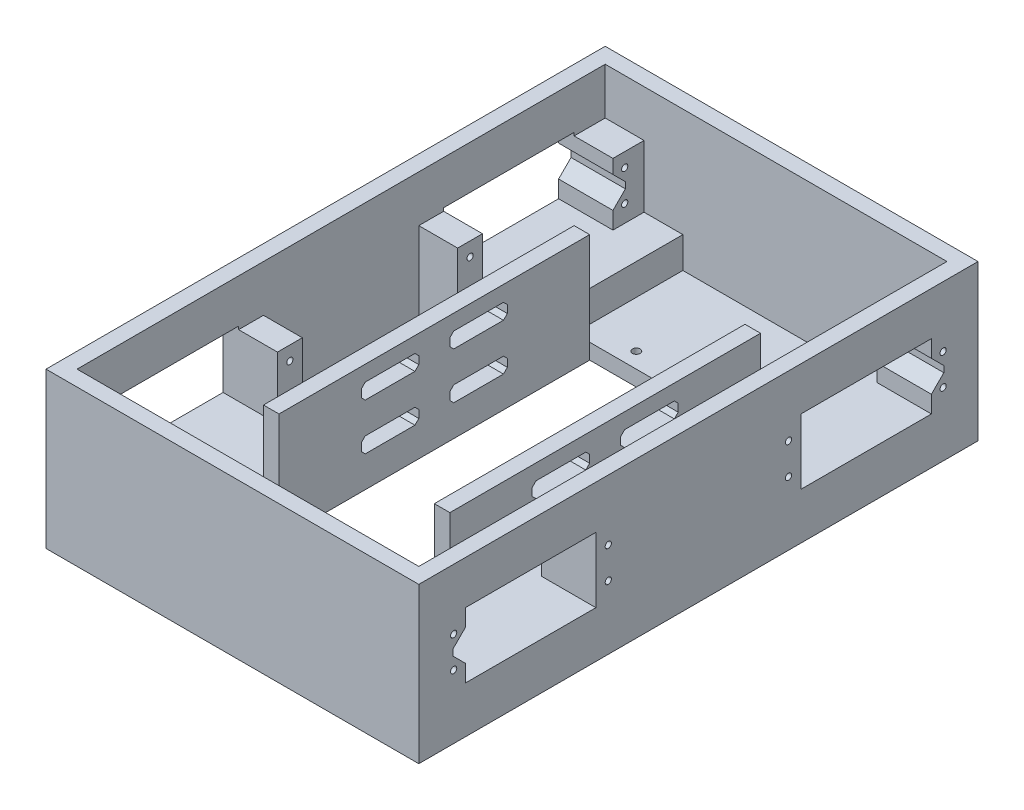
from build123d import *

# Parameters (mm, degrees)
SKETCH1_W               = 120
SKETCH1_H               = 180
BOSS_EXTRUDE1_DEPTH     = 50
SHELL1_T                = -5
SKETCH2_W               = 5
SKETCH2_H               = 100
BOSS_EXTRUDE2_DEPTH     = 30
SKETCH3_W               = 25
SKETCH3_H               = 60
BOSS_EXTRUDE3_DEPTH     = 30
CUT_EXTRUDE1_REACH      = 224.036
SKETCH4_R               = 1
SKETCH5_W               = 12.5
SKETCH5_H               = 60
CUT_EXTRUDE2_DEPTH      = 20
CUT_EXTRUDE4_DEPTH      = 10
SKETCH6_R               = 1.25
SKETCH6_W               = 50
SKETCH6_H               = 100
CUT_EXTRUDE3_DEPTH      = 10
MIRROR2_COPY_1_SKETCH_W = 25
MIRROR2_COPY_1_SKETCH_H = 60
MIRROR2_COPY_1_DEPTH    = 30
MIRROR2_COPY_2_REACH    = 224.036
MIRROR2_COPY_2_SKETCH_R = 1
MIRROR2_COPY_3_SKETCH_W = 12.5
MIRROR2_COPY_3_SKETCH_H = 60
MIRROR2_COPY_3_DEPTH    = 20
MIRROR2_COPY_4_DEPTH    = 10


with BuildPart() as part:
    # Sketch1 → Boss-Extrude1 (new body)
    with BuildSketch(Plane(origin=(0, 0, 0), x_dir=(1, 0, 0), z_dir=(0, 1, 0))):
        with Locations((0, 90)):
            Rectangle(SKETCH1_W, SKETCH1_H)
    extrude(amount=BOSS_EXTRUDE1_DEPTH)

    # Shell1
    shell1_openings = [part.faces().sort_by_distance(p)[0] for p in [
        (0, 50, -90),
    ]]
    offset(amount=SHELL1_T, openings=shell1_openings, kind=Kind.INTERSECTION)

    # Sketch2 → Boss-Extrude2 (add)
    with BuildSketch(Plane(origin=(0, 5, 0), x_dir=(1, 0, 0), z_dir=(0, 1, 0))):
        with Locations((-27.5, 90)):
            Rectangle(SKETCH2_W, SKETCH2_H)
        with Locations((27.5, 90)):
            Rectangle(SKETCH2_W, SKETCH2_H)
    extrude(amount=BOSS_EXTRUDE2_DEPTH)

    # Sketch3 → Boss-Extrude3 (add)
    with BuildSketch(Plane(origin=(0, 5, 0), x_dir=(1, 0, 0), z_dir=(0, 1, 0))):
        with Locations((-42.5, 35)):
            Rectangle(SKETCH3_W, SKETCH3_H)
    boss_extrude3 = extrude(amount=BOSS_EXTRUDE3_DEPTH)

    # Cut-Extrude1: up to this face of the body (flat: up to its plane)
    cut_extrude1_end = Plane(part.part.faces().sort_by_distance((-30, 20, -102.5))[0])
    # Sketch4 → Cut-Extrude1 (cut, up to the picked face)
    with BuildSketch(Plane.ZY.offset(60), mode=Mode.PRIVATE) as cut_extrude1_sk1:
        with Locations((-61, 30.5)):
            Circle(SKETCH4_R)
    cut_extrude1_tool1 = split(extrude(cut_extrude1_sk1.sketch, amount=-CUT_EXTRUDE1_REACH, mode=Mode.PRIVATE), bisect_by=cut_extrude1_end, keep=Keep.BOTH, mode=Mode.PRIVATE)
    # Sketch4 → Cut-Extrude1 (cut, up to the picked face)
    with BuildSketch(Plane.ZY.offset(60), mode=Mode.PRIVATE) as cut_extrude1_sk2:
        with Locations((-61, 20.5)):
            Circle(SKETCH4_R)
    cut_extrude1_tool2 = split(extrude(cut_extrude1_sk2.sketch, amount=-CUT_EXTRUDE1_REACH, mode=Mode.PRIVATE), bisect_by=cut_extrude1_end, keep=Keep.BOTH, mode=Mode.PRIVATE)
    # Sketch4 → Cut-Extrude1 (cut, up to the picked face)
    with BuildSketch(Plane.ZY.offset(60), mode=Mode.PRIVATE) as cut_extrude1_sk3:
        with Locations((-11.220773398, 30.5)):
            Circle(SKETCH4_R)
    cut_extrude1_tool3 = split(extrude(cut_extrude1_sk3.sketch, amount=-CUT_EXTRUDE1_REACH, mode=Mode.PRIVATE), bisect_by=cut_extrude1_end, keep=Keep.BOTH, mode=Mode.PRIVATE)
    # Sketch4 → Cut-Extrude1 (cut, up to the picked face)
    with BuildSketch(Plane.ZY.offset(60), mode=Mode.PRIVATE) as cut_extrude1_sk4:
        with Locations((-11.220773398, 20.5)):
            Circle(SKETCH4_R)
    cut_extrude1_tool4 = split(extrude(cut_extrude1_sk4.sketch, amount=-CUT_EXTRUDE1_REACH, mode=Mode.PRIVATE), bisect_by=cut_extrude1_end, keep=Keep.BOTH, mode=Mode.PRIVATE)
    # Sketch4 → Cut-Extrude1 (cut, up to the picked face)
    with BuildSketch(Plane.ZY.offset(60), mode=Mode.PRIVATE) as cut_extrude1_sk5:
        Polygon((-57, 15), (-15, 15), (-15, 20.5), (-11, 24.5), (-11, 26.5), (-15, 30.5), (-15, 36), (-57, 36), align=None)
    cut_extrude1_tool5 = split(extrude(cut_extrude1_sk5.sketch, amount=-CUT_EXTRUDE1_REACH, mode=Mode.PRIVATE), bisect_by=cut_extrude1_end, keep=Keep.BOTH, mode=Mode.PRIVATE)
    cut_extrude1_1 = cut_extrude1_tool1.solids().sort_by(Axis((-60, 30.5, -61), (1, 0, 0)))[0]
    add(cut_extrude1_1, mode=Mode.SUBTRACT)
    cut_extrude1_2 = cut_extrude1_tool2.solids().sort_by(Axis((-60, 20.5, -61), (1, 0, 0)))[0]
    add(cut_extrude1_2, mode=Mode.SUBTRACT)
    cut_extrude1_3 = cut_extrude1_tool3.solids().sort_by(Axis((-60, 30.5, -11.220773), (1, 0, 0)))[0]
    add(cut_extrude1_3, mode=Mode.SUBTRACT)
    cut_extrude1_4 = cut_extrude1_tool4.solids().sort_by(Axis((-60, 20.5, -11.220773), (1, 0, 0)))[0]
    add(cut_extrude1_4, mode=Mode.SUBTRACT)
    cut_extrude1_5 = cut_extrude1_tool5.solids().sort_by(Axis((-60, 25.5, -35.402502), (1, 0, 0)))[0]
    add(cut_extrude1_5, mode=Mode.SUBTRACT)
    cut_extrude1 = cut_extrude1_1 + cut_extrude1_2 + cut_extrude1_3 + cut_extrude1_4 + cut_extrude1_5  # Cut-Extrude1 as one shape, for the pattern or mirror that repeats it

    # Sketch5 → Cut-Extrude2 (cut)
    with BuildSketch(Plane(origin=(0, 35, 0), x_dir=(1, 0, 0), z_dir=(0, 1, 0))):
        with Locations((-36.25, 35)):
            Rectangle(SKETCH5_W, SKETCH5_H)
    cut_extrude2 = extrude(amount=-CUT_EXTRUDE2_DEPTH, mode=Mode.SUBTRACT)

    # Sketch7 → Cut-Extrude4 (cut)
    with BuildSketch(Plane(origin=(-25, 0, 0), x_dir=(0, 0, -1), z_dir=(1, 0, 0))):
        Polygon((66.5, 28.75), (67.75, 30), (83.75, 30), (85, 28.75), (85, 26.25), (83.75, 25), (67.75, 25), (66.5, 26.25), align=None)
        Polygon((66.5, 13.75), (67.75, 15), (83.75, 15), (85, 13.75), (85, 11.25), (83.75, 10), (67.75, 10), (66.5, 11.25), align=None)
    cut_extrude4 = extrude(amount=-CUT_EXTRUDE4_DEPTH, mode=Mode.SUBTRACT)

    # Sketch6 → Cut-Extrude3 (cut)
    with BuildSketch(Plane(origin=(0, 5, 0), x_dir=(1, 0, 0), z_dir=(0, 1, 0))):
        with Locations(Location((-15, 145, 0), (0, 0, 270))):
            Circle(SKETCH6_R)
        with Locations(Location((15, 145, 0), (0, 0, 90))):
            Circle(SKETCH6_R)
        with Locations(Location((15, 35, 0), (0, 0, 270))):
            Circle(SKETCH6_R)
        with Locations(Location((-15, 35, 0), (0, 0, 90))):
            Circle(SKETCH6_R)
        with Locations((0, 90)):
            Rectangle(SKETCH6_W, SKETCH6_H)
    extrude(amount=-CUT_EXTRUDE3_DEPTH, mode=Mode.SUBTRACT)

    # Mirror1: Boss-Extrude3, Cut-Extrude1, Cut-Extrude2 across plane
    add(boss_extrude3.mirror(Plane(origin=(0, 0, 0), x_dir=(0, 0, 1), z_dir=(1, 0, 0))))
    add(cut_extrude1.mirror(Plane(origin=(0, 0, 0), x_dir=(0, 0, 1), z_dir=(1, 0, 0))), mode=Mode.SUBTRACT)
    add(cut_extrude2.mirror(Plane(origin=(0, 0, 0), x_dir=(0, 0, 1), z_dir=(1, 0, 0))), mode=Mode.SUBTRACT)

    # Mirror3: Cut-Extrude4 across plane
    add(cut_extrude4.mirror(Plane(origin=(0, 0, 0), x_dir=(0, 0, 1), z_dir=(1, 0, 0))), mode=Mode.SUBTRACT)

    # Mirror2: Boss-Extrude3, Cut-Extrude1, Cut-Extrude2, Cut-Extrude4 across plane
    add(boss_extrude3.mirror(Plane(origin=(0, 0, -90), x_dir=(1, 0, 0), z_dir=(0, 0, -1))))
    add(cut_extrude1.mirror(Plane(origin=(0, 0, -90), x_dir=(1, 0, 0), z_dir=(0, 0, -1))), mode=Mode.SUBTRACT)
    add(cut_extrude2.mirror(Plane(origin=(0, 0, -90), x_dir=(1, 0, 0), z_dir=(0, 0, -1))), mode=Mode.SUBTRACT)
    add(cut_extrude4.mirror(Plane(origin=(0, 0, -90), x_dir=(1, 0, 0), z_dir=(0, 0, -1))), mode=Mode.SUBTRACT)

    # Mirror2 copy 1 sketch → Mirror2 copy 1 (add)
    with BuildSketch(Plane(origin=(0, 5, -180), x_dir=(-1, 0, 0), z_dir=(0, 1, 0))):
        with Locations((-42.5, 35)):
            Rectangle(MIRROR2_COPY_1_SKETCH_W, MIRROR2_COPY_1_SKETCH_H)
    extrude(amount=MIRROR2_COPY_1_DEPTH)

    # Mirror2 copy 2: up to this face of the body (flat: up to its plane)
    mirror2_copy_2_end = Plane(part.part.faces().sort_by_distance((30, 20, -77.5))[0])
    # Mirror2 copy 2 sketch → Mirror2 copy 2 (cut, up to the picked face)
    with BuildSketch(Plane(origin=(60, 0, -180), x_dir=(0, 0, -1), z_dir=(1, 0, 0)), mode=Mode.PRIVATE) as mirror2_copy_2_sk1:
        with Locations((-61, 30.5)):
            Circle(MIRROR2_COPY_2_SKETCH_R)
    mirror2_copy_2_tool1 = split(extrude(mirror2_copy_2_sk1.sketch, amount=-MIRROR2_COPY_2_REACH, mode=Mode.PRIVATE), bisect_by=mirror2_copy_2_end, keep=Keep.BOTH, mode=Mode.PRIVATE)
    # Mirror2 copy 2 sketch → Mirror2 copy 2 (cut, up to the picked face)
    with BuildSketch(Plane(origin=(60, 0, -180), x_dir=(0, 0, -1), z_dir=(1, 0, 0)), mode=Mode.PRIVATE) as mirror2_copy_2_sk2:
        with Locations((-61, 20.5)):
            Circle(MIRROR2_COPY_2_SKETCH_R)
    mirror2_copy_2_tool2 = split(extrude(mirror2_copy_2_sk2.sketch, amount=-MIRROR2_COPY_2_REACH, mode=Mode.PRIVATE), bisect_by=mirror2_copy_2_end, keep=Keep.BOTH, mode=Mode.PRIVATE)
    # Mirror2 copy 2 sketch → Mirror2 copy 2 (cut, up to the picked face)
    with BuildSketch(Plane(origin=(60, 0, -180), x_dir=(0, 0, -1), z_dir=(1, 0, 0)), mode=Mode.PRIVATE) as mirror2_copy_2_sk3:
        with Locations((-11.220773398, 30.5)):
            Circle(MIRROR2_COPY_2_SKETCH_R)
    mirror2_copy_2_tool3 = split(extrude(mirror2_copy_2_sk3.sketch, amount=-MIRROR2_COPY_2_REACH, mode=Mode.PRIVATE), bisect_by=mirror2_copy_2_end, keep=Keep.BOTH, mode=Mode.PRIVATE)
    # Mirror2 copy 2 sketch → Mirror2 copy 2 (cut, up to the picked face)
    with BuildSketch(Plane(origin=(60, 0, -180), x_dir=(0, 0, -1), z_dir=(1, 0, 0)), mode=Mode.PRIVATE) as mirror2_copy_2_sk4:
        with Locations((-11.220773398, 20.5)):
            Circle(MIRROR2_COPY_2_SKETCH_R)
    mirror2_copy_2_tool4 = split(extrude(mirror2_copy_2_sk4.sketch, amount=-MIRROR2_COPY_2_REACH, mode=Mode.PRIVATE), bisect_by=mirror2_copy_2_end, keep=Keep.BOTH, mode=Mode.PRIVATE)
    # Mirror2 copy 2 sketch → Mirror2 copy 2 (cut, up to the picked face)
    with BuildSketch(Plane(origin=(60, 0, -180), x_dir=(0, 0, -1), z_dir=(1, 0, 0)), mode=Mode.PRIVATE) as mirror2_copy_2_sk5:
        Polygon((-57, 15), (-15, 15), (-15, 20.5), (-11, 24.5), (-11, 26.5), (-15, 30.5), (-15, 36), (-57, 36), align=None)
    mirror2_copy_2_tool5 = split(extrude(mirror2_copy_2_sk5.sketch, amount=-MIRROR2_COPY_2_REACH, mode=Mode.PRIVATE), bisect_by=mirror2_copy_2_end, keep=Keep.BOTH, mode=Mode.PRIVATE)
    add(mirror2_copy_2_tool1.solids().sort_by(Axis((60, 30.5, -119), (-1, 0, 0)))[0], mode=Mode.SUBTRACT)
    add(mirror2_copy_2_tool2.solids().sort_by(Axis((60, 20.5, -119), (-1, 0, 0)))[0], mode=Mode.SUBTRACT)
    add(mirror2_copy_2_tool3.solids().sort_by(Axis((60, 30.5, -168.779227), (-1, 0, 0)))[0], mode=Mode.SUBTRACT)
    add(mirror2_copy_2_tool4.solids().sort_by(Axis((60, 20.5, -168.779227), (-1, 0, 0)))[0], mode=Mode.SUBTRACT)
    add(mirror2_copy_2_tool5.solids().sort_by(Axis((60, 25.5, -144.597498), (-1, 0, 0)))[0], mode=Mode.SUBTRACT)

    # Mirror2 copy 3 sketch → Mirror2 copy 3 (cut)
    with BuildSketch(Plane(origin=(0, 35, -180), x_dir=(-1, 0, 0), z_dir=(0, 1, 0))):
        with Locations((-36.25, 35)):
            Rectangle(MIRROR2_COPY_3_SKETCH_W, MIRROR2_COPY_3_SKETCH_H)
    extrude(amount=-MIRROR2_COPY_3_DEPTH, mode=Mode.SUBTRACT)

    # Mirror2 copy 4 sketch → Mirror2 copy 4 (cut)
    with BuildSketch(Plane(origin=(25, 0, -180), x_dir=(0, 0, 1), z_dir=(-1, 0, 0))):
        Polygon((66.5, 28.75), (67.75, 30), (83.75, 30), (85, 28.75), (85, 26.25), (83.75, 25), (67.75, 25), (66.5, 26.25), align=None)
        Polygon((66.5, 13.75), (67.75, 15), (83.75, 15), (85, 13.75), (85, 11.25), (83.75, 10), (67.75, 10), (66.5, 11.25), align=None)
    extrude(amount=-MIRROR2_COPY_4_DEPTH, mode=Mode.SUBTRACT)


solid = part.part
